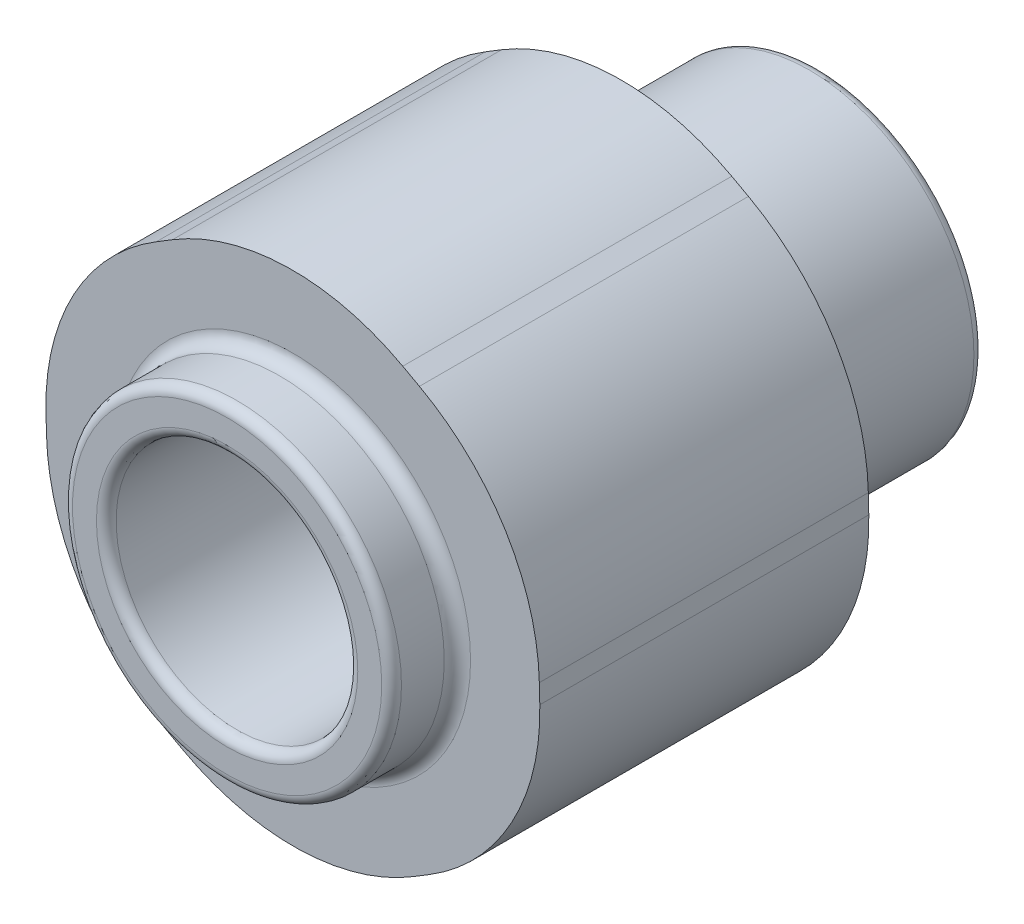
from build123d import *

# Parameters (mm, degrees)
BOSS_EXTRUDE1_DEPTH = 10
SKETCH2_R           = 5
BOSS_EXTRUDE2_DEPTH = 6
FILLET1_R           = 0.4
BOSS_EXTRUDE3_START = 2
SKETCH3_R           = 5
BOSS_EXTRUDE3_DEPTH = 2
FILLET3_R           = 0.4
SKETCH4_R           = 3.67200106
CUT_EXTRUDE1_DEPTH  = 18
FILLET4_R           = 0.3
FILLET5_R           = 7


with BuildPart() as part:
    # Sketch1 → Boss-Extrude1 (new body)
    with BuildSketch(Plane.XY):
        Polygon((7.393488137, 4.509582372), (-0.208668827, 8.657739735), (-7.602156963, 4.148157363), (-7.393488137, -4.509582372), (0.208668827, -8.657739735), (7.602156963, -4.148157363), align=None)
    extrude(amount=BOSS_EXTRUDE1_DEPTH)

    # Sketch2 → Boss-Extrude2 (add)
    with BuildSketch(Plane(origin=(0, 0, 0), x_dir=(-1, 0, 0), z_dir=(0, 0, -1))):
        Circle(SKETCH2_R)
    extrude(amount=BOSS_EXTRUDE2_DEPTH)

    # Fillet1
    fillet1_edges = [part.edges().sort_by_distance(p)[0] for p in [
        (5, 0, 0),
    ]]
    fillet(fillet1_edges, radius=FILLET1_R)

    # Sketch3 → Boss-Extrude3 (add)
    with BuildSketch(Plane.XY.offset(10).offset(BOSS_EXTRUDE3_START)):
        Circle(SKETCH3_R)
    extrude(amount=-BOSS_EXTRUDE3_DEPTH)

    # Fillet3
    fillet3_edges = [part.edges().sort_by_distance(p)[0] for p in [
        (-5, 0, 10),
    ]]
    fillet(fillet3_edges, radius=FILLET3_R)

    # Sketch4 → Cut-Extrude1 (cut)
    with BuildSketch(Plane.XY.offset(12)):
        Circle(SKETCH4_R)
    extrude(amount=-CUT_EXTRUDE1_DEPTH, mode=Mode.SUBTRACT)

    # Fillet4
    fillet4_edges = [part.edges().sort_by_distance(p)[0] for p in [
        (5, 0, -6),
        (-5, 0, 12),
        (-3.67200106, 0, -6),
        (-3.67200106, 0, 12),
    ]]
    fillet(fillet4_edges, radius=FILLET4_R)

    # Fillet5
    fillet5_edges = [part.edges().sort_by_distance(p)[0] for p in [
        (7.602156963, -4.148157363, 5),
        (0.208668827, -8.657739735, 5),
        (-7.393488137, -4.509582372, 5),
        (-7.602156963, 4.148157363, 5),
        (-0.208668827, 8.657739735, 5),
        (7.393488137, 4.509582372, 5),
    ]]
    fillet(fillet5_edges, radius=FILLET5_R)


solid = part.part
